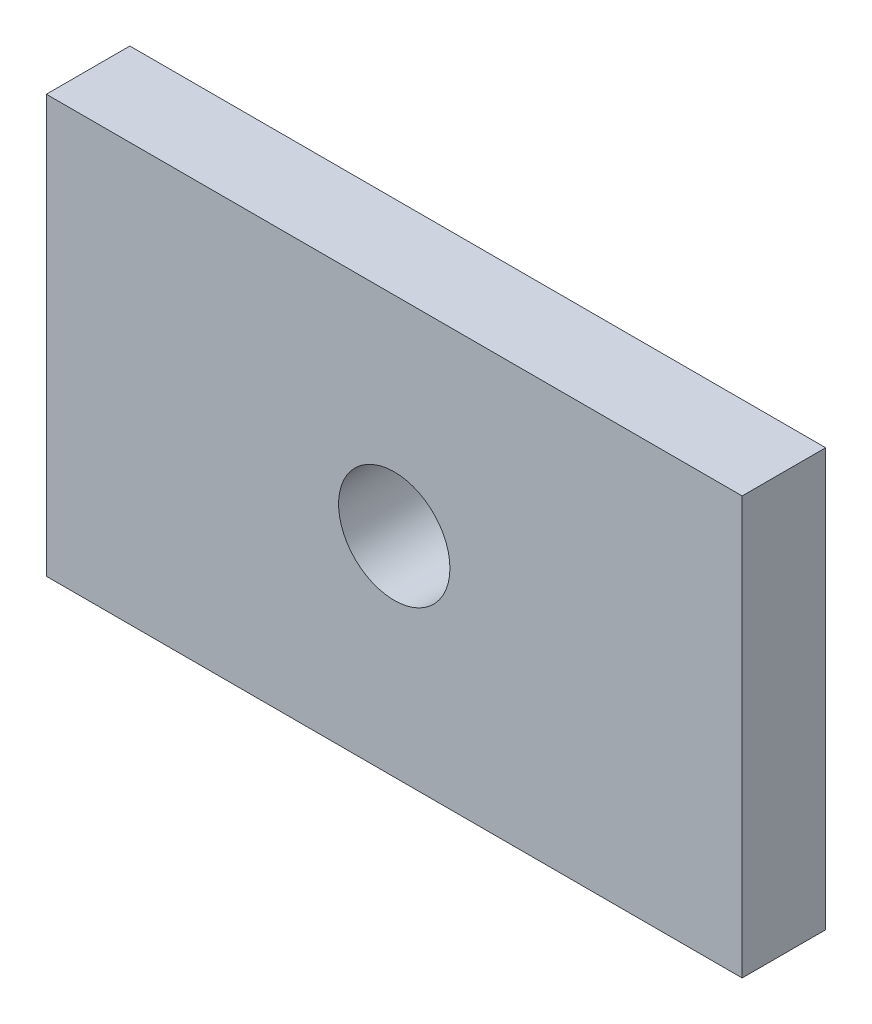
from build123d import *

# Parameters (mm, degrees)
SKETCH1_W           = 25
SKETCH1_H           = 15
SKETCH1_R           = 2
BOSS_EXTRUDE1_DEPTH = 3


with BuildPart() as part:
    # Sketch1 → Boss-Extrude1 (new body)
    with BuildSketch(Plane.XY):
        with Locations((-12.5, 7.5)):
            Rectangle(SKETCH1_W, SKETCH1_H)
        with Locations((-12.5, 7.5)):
            Circle(SKETCH1_R, mode=Mode.SUBTRACT)
    extrude(amount=BOSS_EXTRUDE1_DEPTH)


solid = part.part
